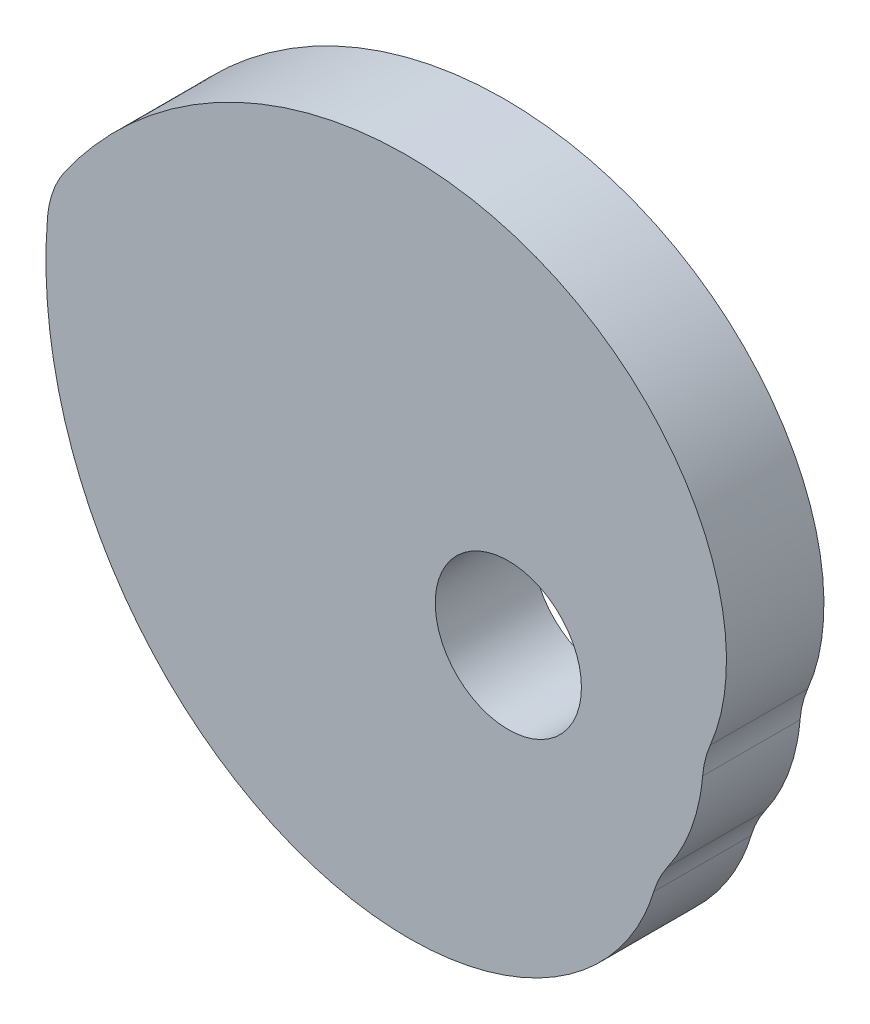
from build123d import *

# Parameters (mm, degrees)
SKETCH1_R           = 7.5
BOSS_EXTRUDE2_DEPTH = 10
FILLET1_R           = 10


with BuildPart() as part:
    # Sketch1 → Boss-Extrude2 (new body)
    with BuildSketch(Plane.XY):
        with BuildLine():
            add(Edge.make_bspline(
                [(20, 0), (20.020409748, 0.037996513), (20.060928024, 0.114187014), (20.12964942, 0.245531013), (20.227524178, 0.436799942), (20.320803466, 0.624005393), (20.408101904, 0.80454476), (20.513131341, 1.028153853), (20.636379782, 1.30013819), (20.775890348, 1.622275603), (20.964561763, 2.084363584), (21.176160839, 2.645597494), (21.400762948, 3.308060339), (21.627348817, 4.074879511), (21.82387956, 4.849852237), (21.990628499, 5.631814908), (22.127804945, 6.419471307), (22.343605386, 8.00388274), (22.444295112, 10.004224504), (22.324306643, 12.205875028), (21.865414458, 14.9688026), (21.194781507, 17.482815576), (20.196975773, 20.103806606), (18.711348901, 22.943135572), (16.913850005, 25.595374807), (14.83803254, 28.035320632), (12.481825943, 30.276438116), (9.905551794, 32.260621181), (7.143058118, 33.975373516), (3.508895363, 35.76599482), (-1.037505048, 37.342198382), (-5.776049389, 38.226758726), (-10.58060247, 38.430948462), (-14.572645562, 38.161653345), (-17.738378195, 37.689516547), (-20.856812898, 36.968897142), (-23.909970253, 36.009023208), (-26.881276298, 34.820013511), (-29.755513368, 33.41273371), (-32.518812511, 31.798646577), (-34.82859609, 30.215871445), (-36.724133372, 28.745155323), (-38.244357448, 27.447549659), (-39.423774282, 26.367755023), (-40.565156508, 25.248103031), (-41.667740599, 24.089758356), (-42.597224858, 23.04452492), (-43.368854904, 22.125890975), (-44.11890301, 21.191619014), (-44.849652331, 20.238158336), (-45.491908008, 19.351069223), (-46.0606176, 18.522333813), (-46.44278908, 17.945992785), (-46.663264674, 17.607165405), (-46.845252854, 17.321947665), (-46.938757793, 17.174061248), (-46.984631039, 17.101007167)],
                knots=[0.050324208, 0.050324208, 0.050324208, 0.050324208, 0.050324208, 0.052007215, 0.053690221, 0.055373228, 0.057056234, 0.058739241, 0.060422248, 0.063788261, 0.067154274, 0.070520287, 0.077252313, 0.083984355, 0.090716396, 0.097448438, 0.10418048, 0.110912521, 0.117644561, 0.151304782, 0.171500944, 0.184965059, 0.211893341, 0.238821591, 0.265749806, 0.292678076, 0.319606256, 0.346534414, 0.375101607, 0.402029829, 0.428958051, 0.48281442, 0.536670848, 0.563599055, 0.590527261, 0.61745547, 0.644383679, 0.671311911, 0.698240144, 0.725168325, 0.752096507, 0.779024722, 0.79248883, 0.805952937, 0.819417041, 0.832881144, 0.846345248, 0.859809351, 0.866541414, 0.873273478, 0.886737604, 0.900201731, 0.903567763, 0.906933794, 0.910299826, 0.913665858, 0.913665858, 0.913665858, 0.913665858, 0.913665858], degree=4))
            add(Edge.make_bspline(
                [(-46.984631039, 17.101007167), (-47.008245687, 16.930252773), (-47.052453505, 16.594747959), (-47.14772288, 15.834487365), (-47.214528259, 15.160715188), (-47.293965593, 14.299779503), (-47.346314657, 13.538629173), (-47.392988991, 12.722186285), (-47.422468156, 11.933538608), (-47.444946495, 10.930726825), (-47.444010053, 9.735376393), (-47.404361039, 8.336368598), (-47.304511764, 6.742720001), (-47.111846077, 4.754565727), (-46.771162846, 2.38206492), (-46.213481433, -0.359572326), (-45.355872486, -3.439660234), (-44.413431344, -6.073991193), (-43.469633124, -8.277605724), (-42.593502891, -10.072305051), (-41.839303321, -11.480778659), (-40.830669548, -13.204502076), (-39.516241362, -15.209384647), (-37.834348338, -17.445666738), (-35.716475971, -19.841921409), (-32.836422898, -22.614479765), (-29.03089004, -25.547737865), (-24.838756286, -27.918909191), (-20.349017446, -29.638470379), (-16.397837157, -30.613103542), (-13.160898489, -31.080464427), (-9.892857606, -31.217237714), (-6.628606497, -31.010938023), (-3.473189469, -30.47401424), (-0.394676097, -29.596112443), (2.565112202, -28.37500671), (5.36075444, -26.812990946), (7.781768771, -25.036326324), (9.9742179, -22.985943497), (11.63958792, -20.986683376), (12.748810807, -19.3214148), (13.515819977, -17.919279199), (13.906378968, -17.109859569), (14.149100741, -16.562152771), (14.339295058, -16.100610712), (14.484089284, -15.728391771), (14.621373048, -15.353433154), (14.751011091, -14.975917501), (14.873112977, -14.594855978), (14.987276237, -14.211724793), (15.091962981, -13.833461004), (15.191298738, -13.439798185), (15.266942281, -13.107906017), (15.303325903, -12.940133069), (15.320888863, -12.855752194)],
                knots=[0.086334142, 0.086334142, 0.086334142, 0.086334142, 0.086334142, 0.093060515, 0.099786888, 0.10651326, 0.113239633, 0.119966006, 0.126692378, 0.133418751, 0.140145123, 0.153597846, 0.167050569, 0.180503291, 0.193956014, 0.220861466, 0.247766918, 0.274672338, 0.301577759, 0.315030493, 0.328483227, 0.341935962, 0.355388696, 0.382294142, 0.409199588, 0.436105031, 0.463010473, 0.516821378, 0.570632207, 0.597537677, 0.624443147, 0.653716038, 0.680621422, 0.707526854, 0.734432293, 0.761337694, 0.788243181, 0.815148711, 0.842054217, 0.862233312, 0.889138718, 0.902591415, 0.909317764, 0.916044113, 0.919407288, 0.922770462, 0.926133629, 0.929496795, 0.932859961, 0.936223127, 0.939586294, 0.94294946, 0.946312626, 0.949675792, 0.949675792, 0.949675792, 0.949675792, 0.949675792], degree=4))
            add(Edge.make_bspline(
                [(15.320888863, -12.855752194), (15.365482074, -12.802608074), (15.453982567, -12.695704505), (15.663171852, -12.439954999), (15.827525813, -12.226893605), (16.052433323, -11.933079522), (16.234262328, -11.682018392), (16.434764749, -11.400135846), (16.616884894, -11.131589611), (16.802556699, -10.850279333), (16.979014347, -10.571395037), (17.196540035, -10.215824071), (17.44658158, -9.785182904), (17.725195173, -9.273842637), (18.023456431, -8.679695549), (18.302106839, -8.075852302), (18.560352889, -7.462892724), (18.798195449, -6.842210014), (19.015199451, -6.212979877), (19.211229439, -5.578581169), (19.386005403, -4.935179764), (19.539372739, -4.291022665), (19.671138501, -3.634366779), (19.781171398, -2.986524336), (19.869341032, -2.3139722), (19.935555478, -1.675574724), (19.974215132, -1.055908566), (19.993553165, -0.61958797), (19.999079015, -0.206445905), (20, -0.069374722), (20, 0)],
                knots=[0.08263773, 0.08263773, 0.08263773, 0.08263773, 0.08263773, 0.102512123, 0.122386517, 0.142260911, 0.162135305, 0.182009699, 0.201884093, 0.221758486, 0.24163288, 0.261507274, 0.281381668, 0.321130456, 0.360879243, 0.400628031, 0.440376819, 0.480125606, 0.519874394, 0.559623181, 0.599371969, 0.639120757, 0.678869544, 0.718618332, 0.75836712, 0.798115907, 0.837864695, 0.877613483, 0.897487877, 0.91736227, 0.91736227, 0.91736227, 0.91736227, 0.91736227], degree=4))
        make_face()
        Circle(SKETCH1_R, mode=Mode.SUBTRACT)
    extrude(amount=BOSS_EXTRUDE2_DEPTH)

    # Fillet1
    fillet1_edges = [part.edges().sort_by_distance(p)[0] for p in [
        (-46.984631039, 17.101007167, 5),
        (15.320888863, -12.855752194, 5),
        (20, 0, 5),
    ]]
    fillet(fillet1_edges, radius=FILLET1_R)


solid = part.part
